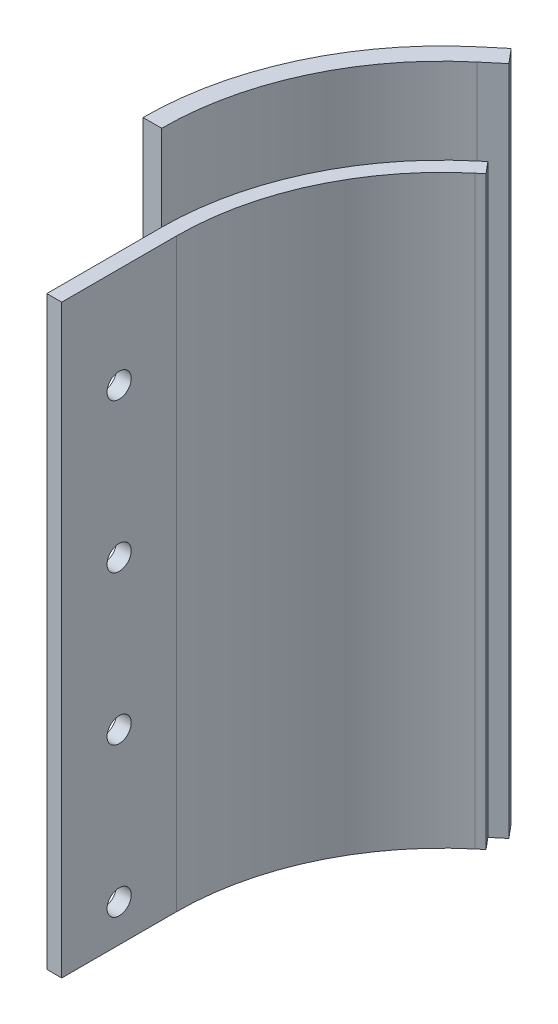
from build123d import *

# Parameters (mm, degrees)
SKETCH1_R           = 2.6
BOSS_EXTRUDE1_DEPTH = 20
BOSS_EXTRUDE2_DEPTH = 20
BOSS_EXTRUDE3_DEPTH = 180
CUT_EXTRUDE1_DEPTH  = 195.584574731
BOSS_EXTRUDE4_START = -23
BOSS_EXTRUDE4_DEPTH = 157
SKETCH7_R           = 3.25
CUT_EXTRUDE2_DEPTH  = 214.175157885
CUT_EXTRUDE3_DEPTH  = 194.031130578


with BuildPart() as part:
    # Sketch1 → Boss-Extrude1 (new body)
    with BuildSketch(Plane(origin=(0, 0, 0), x_dir=(1, 0, 0), z_dir=(0, 1, 0))):
        with BuildLine():
            Line((10, 0), (-10, 0))
            ThreePointArc((-10, 0), (-2.947752983, 31.810630591), (16.887506811, 57.660444431))
            Line((16.887506811, 57.660444431), (29.743259005, 42.339555569))
            ThreePointArc((29.743259005, 42.339555569), (15.178402758, 23.358265357), (10, 0))
        make_face()
        with Locations(Location((0.770593323, 10, 0), (0, 0, 270))):
            Circle(SKETCH1_R, mode=Mode.SUBTRACT)
        with Locations(Location((6.115324888, 27.584447974, 0), (0, 0, 270))):
            Circle(SKETCH1_R, mode=Mode.SUBTRACT)
        with Locations(Location((16.150266317, 42.98181517, 0), (0, 0, 270))):
            Circle(SKETCH1_R, mode=Mode.SUBTRACT)
    extrude(amount=BOSS_EXTRUDE1_DEPTH)

    # Sketch2 → Boss-Extrude2 (add)
    with BuildSketch(Plane(origin=(0, 20, 0), x_dir=(1, 0, 0), z_dir=(0, 1, 0))):
        Polygon((16.887506811, 57.660444431), (29.743259005, 42.339555569), (34.416130108, 46.260559988), (21.560377914, 61.58144885), align=None)
    extrude(amount=-BOSS_EXTRUDE2_DEPTH)

    # Sketch4 → Cut-Extrude1 (cut, through all)
    with BuildSketch(Plane(origin=(0, 20, 0), x_dir=(1, 0, 0), z_dir=(0, 1, 0))):
        with BuildLine():
            Line((29.743259005, 42.339555569), (34.416130108, 46.260559988))
            Line((34.416130108, 46.260559988), (21.560377914, 61.58144885))
            Line((21.560377914, 61.58144885), (16.887506811, 57.660444431))
            ThreePointArc((16.887506811, 57.660444431), (-2.947752983, 31.810630591), (-10, 0))
            Line((-10, 0), (10, 0))
            ThreePointArc((10, 0), (15.178402758, 23.358265357), (29.743259005, 42.339555569))
        make_face()
    extrude(amount=-CUT_EXTRUDE1_DEPTH, mode=Mode.SUBTRACT)


with BuildPart() as body_2:
    # Sketch3 → Boss-Extrude3 (new body)
    with BuildSketch(Plane(origin=(0, 20, 0), x_dir=(1, 0, 0), z_dir=(0, 1, 0))):
        with BuildLine():
            Line((18.346439865, 65.411671066), (13.673568762, 61.490666647))
            ThreePointArc((13.673568762, 61.490666647), (-7.479291918, 33.9237219), (-15, 0))
            Line((-15, 0), (-10, 0))
            ThreePointArc((-10, 0), (-2.947752983, 31.810630591), (16.887506811, 57.660444431))
            Line((16.887506811, 57.660444431), (21.560377914, 61.58144885))
            Line((21.560377914, 61.58144885), (18.346439865, 65.411671066))
        make_face()
    extrude(amount=BOSS_EXTRUDE3_DEPTH)

    # Sketch6 → Boss-Extrude4 (add)
    with BuildSketch(Plane(origin=(0, 200, 0), x_dir=(1, 0, 0), z_dir=(0, 1, 0)).offset(BOSS_EXTRUDE4_START)):
        with BuildLine():
            Line((16.887506811, 57.660444431), (21.560377914, 61.58144885))
            Line((21.560377914, 61.58144885), (24.131528353, 58.517271078))
            Line((24.131528353, 58.517271078), (19.45865725, 54.596266659))
            ThreePointArc((19.45865725, 54.596266659), (0.677478166, 30.120157545), (-6, 0))
            Line((-6, 0), (-6, -30.799181984))
            Line((-6, -30.799181984), (-10, -30.799181984))
            Line((-10, -30.799181984), (-10, 0))
            ThreePointArc((-10, 0), (-2.947752983, 31.810630591), (16.887506811, 57.660444431))
        make_face()
    extrude(amount=-BOSS_EXTRUDE4_DEPTH)

    # Sketch7 → Cut-Extrude2 (cut, through all)
    with BuildSketch(Plane.ZY.offset(10)):
        with Locations((15.399590992, 30)):
            Circle(SKETCH7_R)
        with Locations((15.399590992, 70)):
            Circle(SKETCH7_R)
        with Locations((15.399590992, 110)):
            Circle(SKETCH7_R)
        with Locations((15.399590992, 150)):
            Circle(SKETCH7_R)
    extrude(amount=-CUT_EXTRUDE2_DEPTH, mode=Mode.SUBTRACT)

    # Sketch8 → Cut-Extrude3 (cut, through all)
    with BuildSketch(Plane(origin=(0, 200, 0), x_dir=(1, 0, 0), z_dir=(0, 1, 0))):
        Polygon((21.560377914, 61.58144885), (24.131528353, 58.517271078), (21.06735058, 55.946120639), (18.496200141, 59.010298412), align=None)
    extrude(amount=-CUT_EXTRUDE3_DEPTH, mode=Mode.SUBTRACT)


solid = body_2.part
